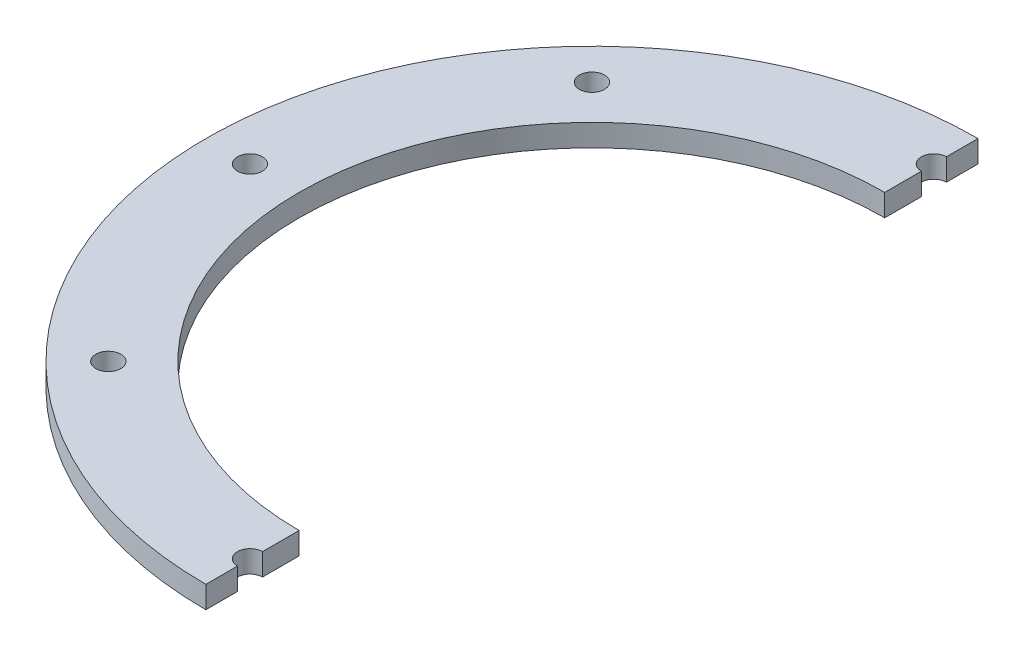
from build123d import *

# Parameters (mm, degrees)
SKETCH1_R           = 1.7
BOSS_EXTRUDE1_DEPTH = 3


with BuildPart() as part:
    # Sketch1 → Boss-Extrude1 (new body)
    with BuildSketch(Plane.XZ):
        with BuildLine():
            Line((0, 52.5), (0, 48.2))
            ThreePointArc((0, 48.2), (-1.7, 46.5), (0, 44.8))
            Line((0, 44.8), (0, 39.816447761))
            ThreePointArc((0, 39.816447761), (-39.816447761, 0), (0, -39.816447761))
            Line((0, -39.816447761), (0, -44.8))
            ThreePointArc((0, -44.8), (-1.7, -46.5), (0, -48.2))
            Line((0, -48.2), (0, -52.5))
            ThreePointArc((0, -52.5), (-52.5, 0), (0, 52.5))
        make_face()
        with Locations(Location((-46.5, 0, 0), (0, 0, 270))):
            Circle(SKETCH1_R, mode=Mode.SUBTRACT)
        with Locations(Location((-32.880465325, 32.880465325, 0), (0, 0, 270))):
            Circle(SKETCH1_R, mode=Mode.SUBTRACT)
        with Locations(Location((-32.880465325, -32.880465325, 0), (0, 0, 90))):
            Circle(SKETCH1_R, mode=Mode.SUBTRACT)
    extrude(amount=BOSS_EXTRUDE1_DEPTH)


solid = part.part
